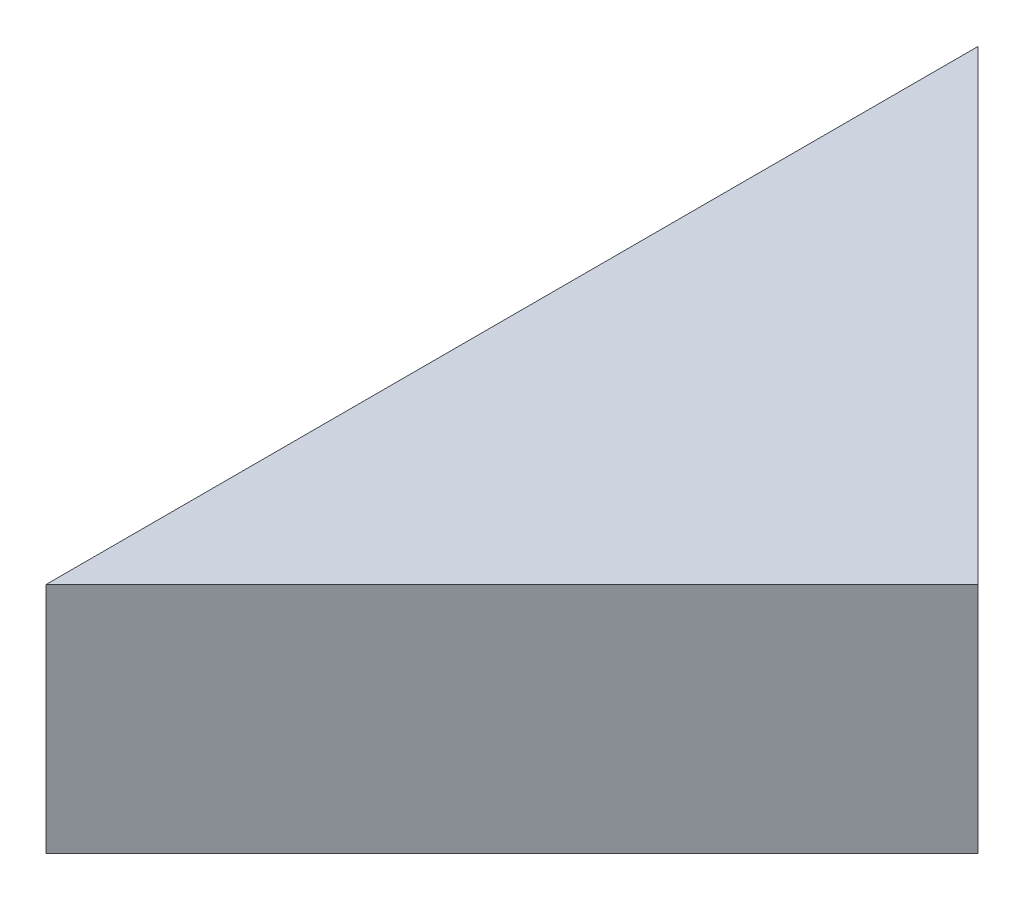
from build123d import *

# Parameters (mm, degrees)
BOSS_EXTRUDE1_DEPTH = 15


with BuildPart() as part:
    # Sketch1 → Boss-Extrude1 (new body)
    with BuildSketch(Plane(origin=(0, 0, 0), x_dir=(1, 0, 0), z_dir=(0, 1, 0))):
        Polygon((0, 0), (0, 60), (30, 30), align=None)
    extrude(amount=BOSS_EXTRUDE1_DEPTH)


solid = part.part
